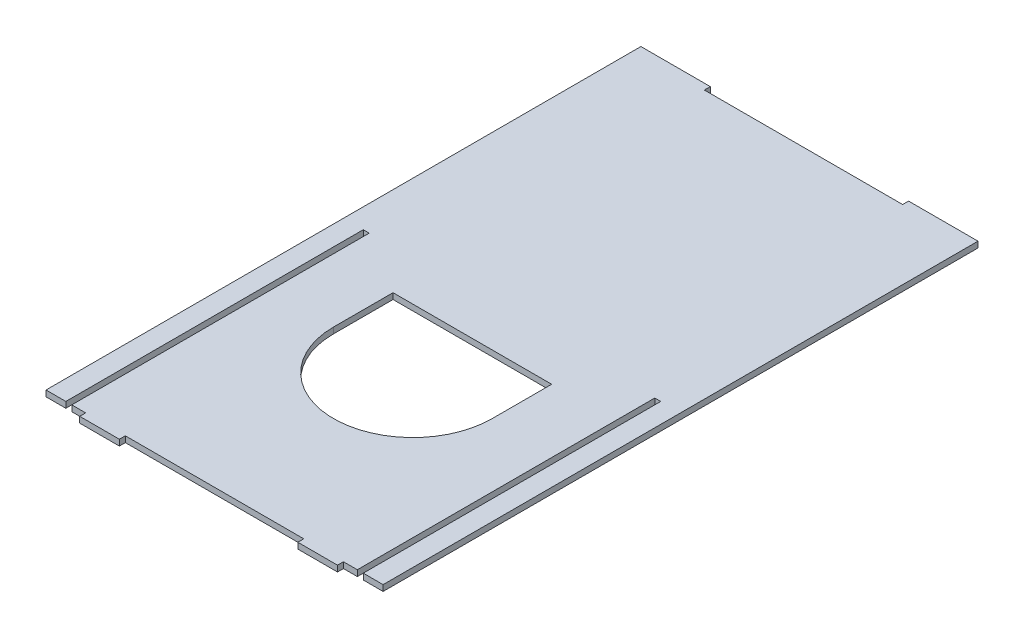
from build123d import *

# Parameters (mm, degrees)
BOSS_EXTRUDE1_DEPTH = 6
SKETCH2_W           = 6
SKETCH2_H           = 300
CUT_EXTRUDE1_DEPTH  = 6
LPATTERN1_COUNT     = 2
LPATTERN1_PITCH     = 294
SKETCH3_W           = 200
SKETCH3_H           = 6
CUT_EXTRUDE2_DEPTH  = 6


with BuildPart() as part:
    # Sketch1 → Boss-Extrude1 (new body)
    with BuildSketch(Plane(origin=(0, 0, 0), x_dir=(1, 0, 0), z_dir=(0, 1, 0))):
        Polygon((300, 0), (300, -6), (260, -6), (260, 0), (80, 0), (80, -6), (40, -6), (40, 0), (0, 0), (0, 600), (340, 600), (340, 0), align=None)
    extrude(amount=BOSS_EXTRUDE1_DEPTH)

    # Sketch2 → Cut-Extrude1 (cut)
    with BuildSketch(Plane(origin=(0, 6, 0), x_dir=(1, 0, 0), z_dir=(0, 1, 0))):
        with Locations((23, 150)):
            Rectangle(SKETCH2_W, SKETCH2_H)
    cut_extrude1 = extrude(amount=-CUT_EXTRUDE1_DEPTH, mode=Mode.SUBTRACT)

    # LPattern1: Cut-Extrude1 ×2
    with Locations(*[(i * LPATTERN1_PITCH, 0, 0) for i in range(1, LPATTERN1_COUNT)]):
        add(cut_extrude1, mode=Mode.SUBTRACT)

    # Sketch3 → Cut-Extrude2 (cut)
    with BuildSketch(Plane(origin=(0, 6, 0), x_dir=(1, 0, 0), z_dir=(0, 1, 0))):
        with BuildLine():
            Line((90, 200), (90, 260))
            Line((90, 260), (250, 260))
            Line((250, 260), (250, 200))
            ThreePointArc((250, 200), (170, 120), (90, 200))
        make_face()
        with Locations((170, 597)):
            Rectangle(SKETCH3_W, SKETCH3_H)
    extrude(amount=-CUT_EXTRUDE2_DEPTH, mode=Mode.SUBTRACT)


solid = part.part
